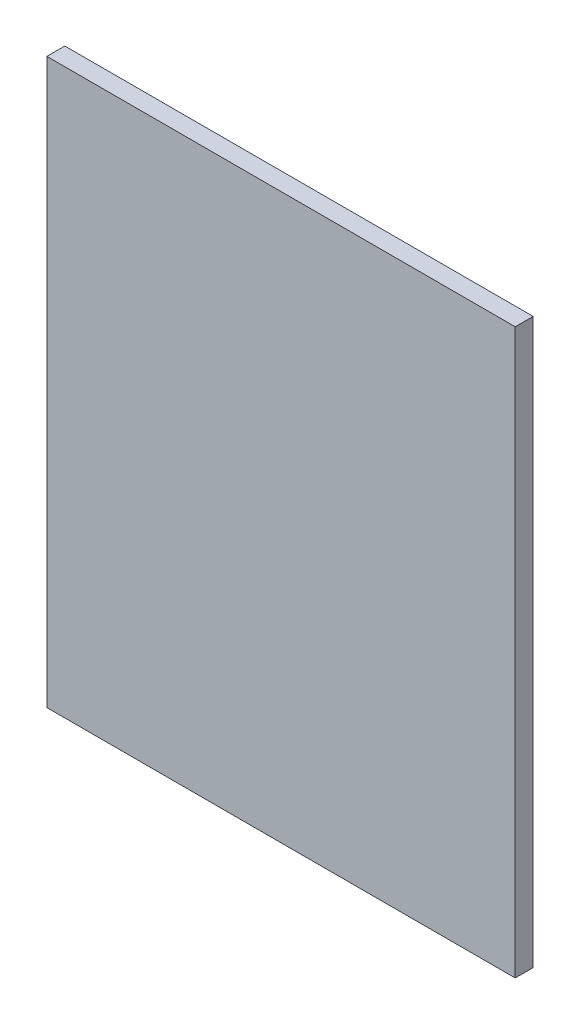
from build123d import *

# Parameters (mm, degrees)
SKETCH1_W           = 470
SKETCH1_H           = 566
BOSS_EXTRUDE1_DEPTH = 18


with BuildPart() as part:
    # Sketch1 → Boss-Extrude1 (new body)
    with BuildSketch(Plane.XY):
        Rectangle(SKETCH1_W, SKETCH1_H)
    extrude(amount=BOSS_EXTRUDE1_DEPTH)


solid = part.part
